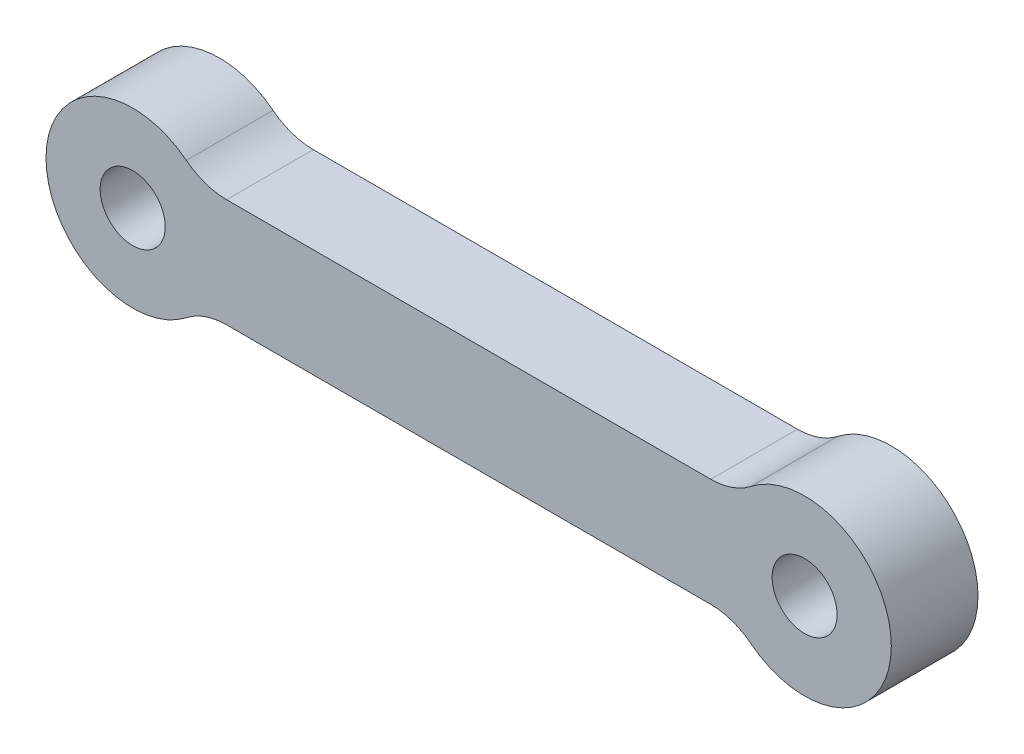
from build123d import *

# Parameters (mm, degrees)
SKETCH2_R           = 1.5
BOSS_EXTRUDE1_DEPTH = 4


with BuildPart() as part:
    # Sketch2 → Boss-Extrude1 (new body)
    with BuildSketch(Plane.XY):
        with BuildLine():
            Line((-11.169872981, 2.5), (11.169872981, 2.5))
            ThreePointArc((11.169872981, 2.5), (12.151853487, 2.665266452), (13.025641703, 3.142857143))
            ThreePointArc((13.025641703, 3.142857143), (19.5, 0), (13.025641703, -3.142857143))
            ThreePointArc((13.025641703, -3.142857143), (12.151853487, -2.665266452), (11.169872981, -2.5))
            Line((11.169872981, -2.5), (-11.169872981, -2.5))
            ThreePointArc((-11.169872981, -2.5), (-12.151853487, -2.665266452), (-13.025641703, -3.142857143))
            ThreePointArc((-13.025641703, -3.142857143), (-19.5, 0), (-13.025641703, 3.142857143))
            ThreePointArc((-13.025641703, 3.142857143), (-12.151853487, 2.665266452), (-11.169872981, 2.5))
        make_face()
        with Locations((-15.5, 0)):
            Circle(SKETCH2_R, mode=Mode.SUBTRACT)
        with Locations(Location((15.5, 0, 0), (0, 0, 180))):
            Circle(SKETCH2_R, mode=Mode.SUBTRACT)
    extrude(amount=BOSS_EXTRUDE1_DEPTH)


solid = part.part
